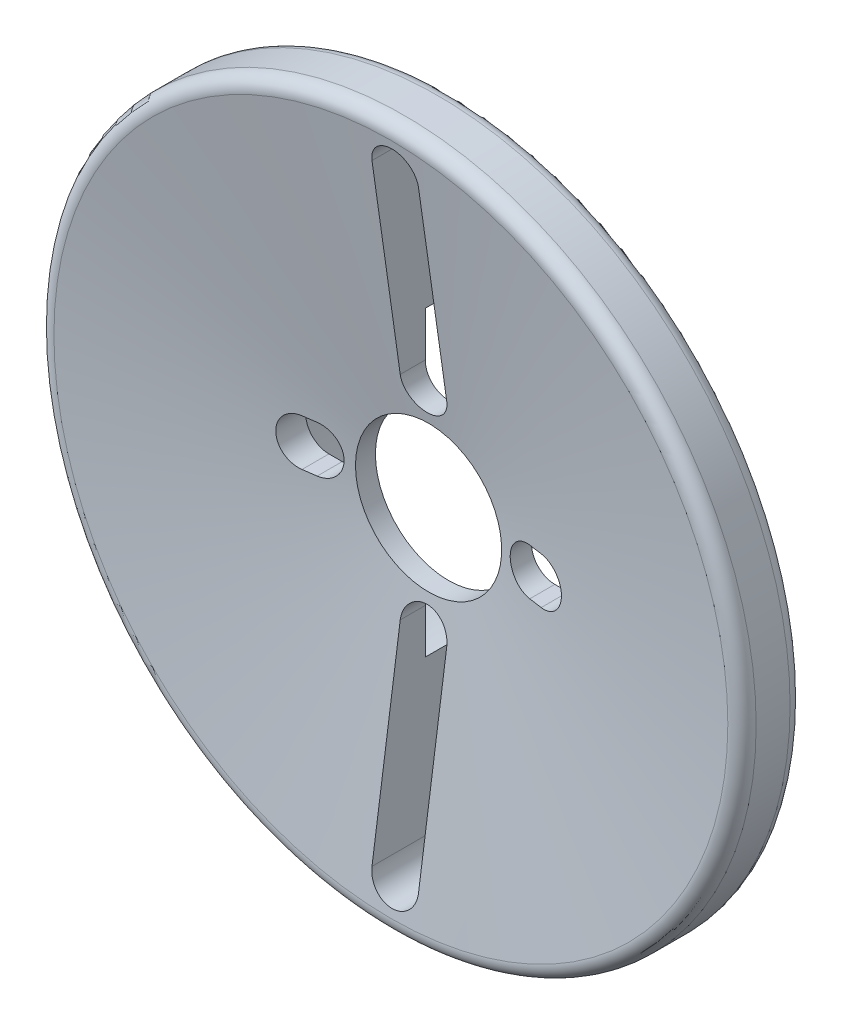
from build123d import *

# Parameters (mm, degrees)
SKETCH1_R           = 26.5
SKETCH1_R_2         = 5.5
BOSS_EXTRUDE1_DEPTH = 1.5
HOLES_DEPTH         = 38.7458607
FILLET2_R           = 1
HOLES_PTR_COUNT     = 2


with BuildPart() as part:
    # Sketch1 → Boss-Extrude1 (new body)
    with BuildSketch(Plane.XY):
        Circle(SKETCH1_R)
        Circle(SKETCH1_R_2, mode=Mode.SUBTRACT)
    extrude(amount=BOSS_EXTRUDE1_DEPTH)

    # Sketch8 → Revolve2 (revolve)
    with BuildSketch(Plane(origin=(0, 0, 0), x_dir=(1, 0, 0), z_dir=(0, 1, 0))):
        Polygon((-11.5, 0), (-11.5, 3.5), (-26.5, 0), align=None)
        Polygon((5.5, -1.5), (26.5, -1.5), (26.5, -4.5), align=None)
    revolve(axis=Axis((0, 0, 0), (0, 0, 1)))

    # Sketch7 → holes (cut, symmetric)
    with BuildSketch(Plane.XY):
        with BuildLine():
            Line((1.75, -8), (1.75, -23))
            ThreePointArc((1.75, -23), (0, -24.75), (-1.75, -23))
            Line((-1.75, -23), (-1.75, -8))
            ThreePointArc((-1.75, -8), (0, -6.25), (1.75, -8))
        make_face()
        with BuildLine():
            Line((8, 1.75), (9, 1.75))
            ThreePointArc((9, 1.75), (10.75, 0), (9, -1.75))
            Line((9, -1.75), (8, -1.75))
            ThreePointArc((8, -1.75), (6.25, 0), (8, 1.75))
        make_face()
    holes = extrude(amount=HOLES_DEPTH, both=True, mode=Mode.SUBTRACT)

    # Fillet2
    fillet2_edges = [part.edges().sort_by_distance(p)[0] for p in [
        (0, 26.5, 0),
        (-26.5, 0, 4.5),
    ]]
    fillet(fillet2_edges, radius=FILLET2_R)

    # holes-ptr: holes ×2 about axis
    holes_ptr_axis = Axis((0, 0, 0), (0, 0, 1))
    for i in range(1, HOLES_PTR_COUNT):
        add(holes.rotate(holes_ptr_axis, i * 360 / HOLES_PTR_COUNT), mode=Mode.SUBTRACT)


solid = part.part
